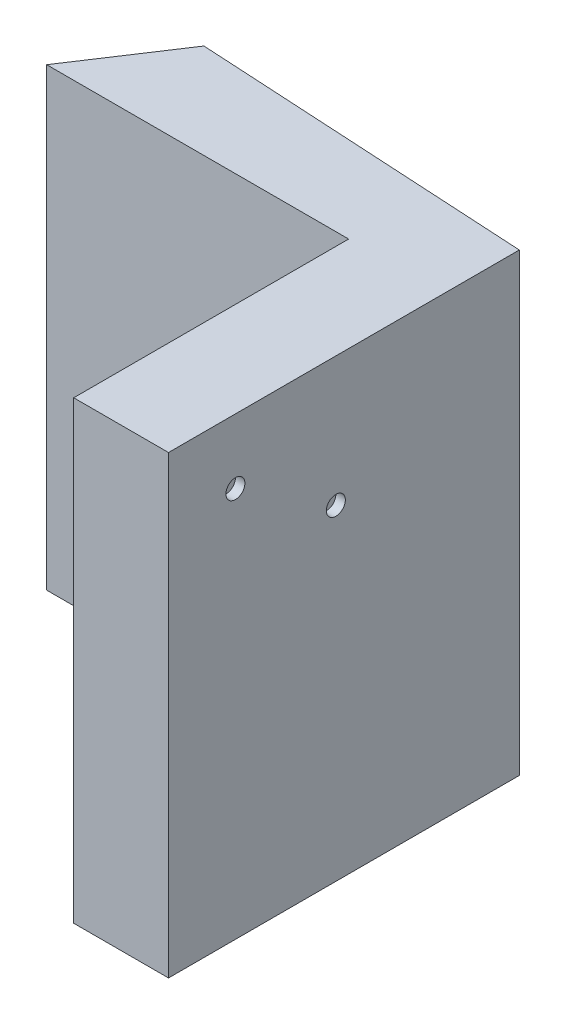
from build123d import *

# Parameters (mm, degrees)
SKETCH1_W           = 41.85
SKETCH1_H           = 10
SKETCH1_W_2         = 10
SKETCH1_H_2         = 29
BOSS_EXTRUDE1_DEPTH = 48
CUT_EXTRUDE1_DEPTH  = 48
SKETCH4_R           = 2
SKETCH4_R_2         = 4.2
CUT_EXTRUDE2_DEPTH  = 48
CUT_EXTRUDE3_DEPTH  = 48
SKETCH6_R           = 1
CUT_EXTRUDE4_DEPTH  = 2
SKETCH7_R           = 1
CUT_EXTRUDE5_DEPTH  = 1
SKETCH8_W           = 65.86504954
SKETCH8_H           = 108.734415267
CUT_EXTRUDE6_DEPTH  = 17.96
BOSS_EXTRUDE2_DEPTH = 17.96
SKETCH10_R          = 1
CUT_EXTRUDE7_DEPTH  = 1
SKETCH11_R          = 1
CUT_EXTRUDE8_DEPTH  = 1


with BuildPart() as part:
    # Sketch1 → Boss-Extrude1 (new body)
    with BuildSketch(Plane(origin=(0, 0, 0), x_dir=(1, 0, 0), z_dir=(0, 1, 0))):
        with Locations((-10.925, 5)):
            Rectangle(SKETCH1_W, SKETCH1_H)
        with Locations((5, -14.5)):
            Rectangle(SKETCH1_W_2, SKETCH1_H_2)
    extrude(amount=BOSS_EXTRUDE1_DEPTH)

    # Sketch3 → Cut-Extrude1 (cut)
    with BuildSketch(Plane(origin=(0, 48, 0), x_dir=(1, 0, 0), z_dir=(0, 1, 0))):
        Polygon((-31.85, 10), (-25.26317425, 10), (-31.85, 0), align=None)
    extrude(amount=-CUT_EXTRUDE1_DEPTH, mode=Mode.SUBTRACT)

    # Sketch4 → Cut-Extrude2 (cut)
    with BuildSketch(Plane.XY):
        with Locations((-5.589559388, 40.980827232)):
            Circle(SKETCH4_R)
        with Locations((-5.629681083, 24.979051073)):
            Circle(SKETCH4_R)
        with Locations((-21.591335547, 41.020948927)):
            Circle(SKETCH4_R)
        with Locations((-21.631457243, 25.019172768)):
            Circle(SKETCH4_R)
        with Locations((-13.629681083, 32.979051073)):
            Circle(SKETCH4_R_2)
    extrude(amount=-CUT_EXTRUDE2_DEPTH, mode=Mode.SUBTRACT)

    # Sketch5 → Cut-Extrude3 (cut)
    with BuildSketch(Plane(origin=(0, 48, 0), x_dir=(1, 0, 0), z_dir=(0, 1, 0))):
        Polygon((-25.26317425, 10), (10, 8), (10, 10), align=None)
    extrude(amount=-CUT_EXTRUDE3_DEPTH, mode=Mode.SUBTRACT)

    # Sketch6 → Cut-Extrude4 (cut)
    with BuildSketch(Plane(origin=(10, 0, 0), x_dir=(0, 0, -1), z_dir=(1, 0, 0))):
        with Locations((-21, 6.391948522)):
            Circle(SKETCH6_R)
        with Locations((-11, 15)):
            Circle(SKETCH6_R)
    extrude(amount=-CUT_EXTRUDE4_DEPTH, mode=Mode.SUBTRACT)

    # Sketch7 → Cut-Extrude5 (cut)
    with BuildSketch(Plane(origin=(0.484340621, 0, -8.539693864), x_dir=(-0.9983954953921488, 0, -0.056625389894163713), z_dir=(0.056625389894163713, 0, -0.9983954953921488))):
        with Locations((10.469048165, 7)):
            Circle(SKETCH7_R)
    extrude(amount=-CUT_EXTRUDE5_DEPTH, mode=Mode.SUBTRACT)

    # Sketch8 → Cut-Extrude6 (cut)
    with BuildSketch(Plane.XZ):
        with Locations((-12.632558392, 5.858470362)):
            Rectangle(SKETCH8_W, SKETCH8_H)
    extrude(amount=-CUT_EXTRUDE6_DEPTH, mode=Mode.SUBTRACT)

    # Sketch9 → Boss-Extrude2 (add)
    with BuildSketch(Plane(origin=(0, 48, 0), x_dir=(1, 0, 0), z_dir=(0, 1, 0))):
        Polygon((10, -29), (0, -29), (0, 0), (-31.85, 0), (-25.26317425, 10), (10, 8), align=None)
    extrude(amount=BOSS_EXTRUDE2_DEPTH)

    # Sketch10 → Cut-Extrude7 (cut)
    with BuildSketch(Plane(origin=(10, 0, 0), x_dir=(0, 0, -1), z_dir=(1, 0, 0))):
        with Locations((-21.942879274, 59.132798009)):
            Circle(SKETCH10_R)
        with Locations((-11.347569505, 52.312182855)):
            Circle(SKETCH10_R)
    extrude(amount=-CUT_EXTRUDE7_DEPTH, mode=Mode.SUBTRACT)

    # Sketch11 → Cut-Extrude8 (cut)
    with BuildSketch(Plane(origin=(0.484340621, 0, -8.539693864), x_dir=(-0.9983954953921488, 0, -0.056625389894163713), z_dir=(0.056625389894163713, 0, -0.9983954953921488))):
        with Locations((1.733457751, 58.349902704)):
            Circle(SKETCH11_R)
    extrude(amount=-CUT_EXTRUDE8_DEPTH, mode=Mode.SUBTRACT)


solid = part.part
